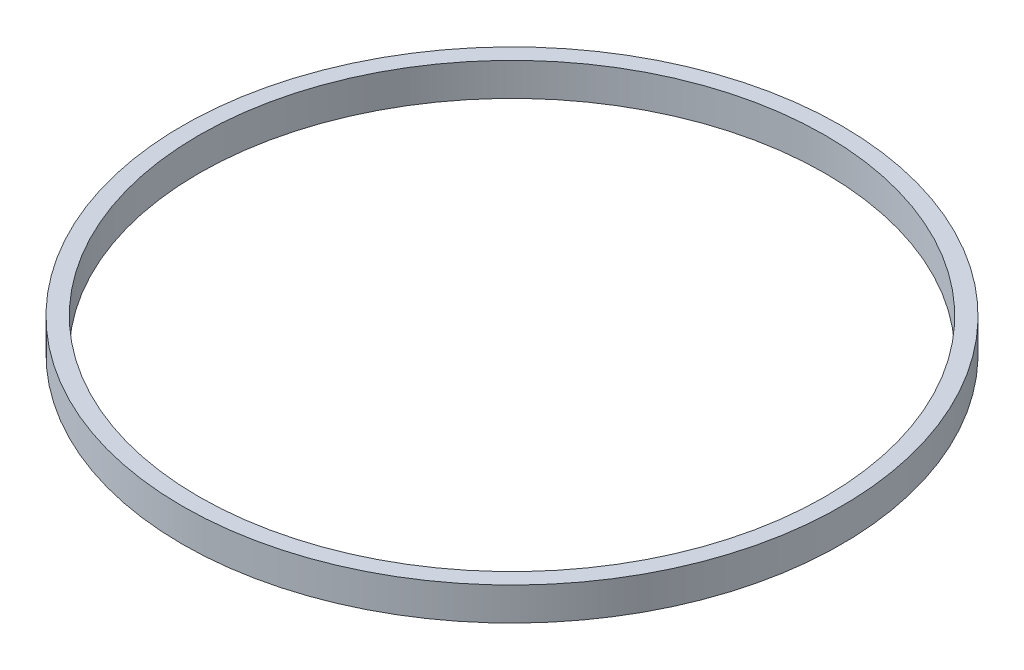
from build123d import *

# Parameters (mm, degrees)
SKETCH1_R           = 25.4
SKETCH1_R_2         = 24.13
BOSS_EXTRUDE1_DEPTH = 2.54


with BuildPart() as part:
    # Sketch1 → Boss-Extrude1 (new body)
    with BuildSketch(Plane(origin=(0, 0, 0), x_dir=(1, 0, 0), z_dir=(0, 1, 0))):
        with Locations(Location((0, 0, 0), (0, 0, 270))):
            Circle(SKETCH1_R)
        with Locations(Location((0, 0, 0), (0, 0, 270))):
            Circle(SKETCH1_R_2, mode=Mode.SUBTRACT)
    extrude(amount=BOSS_EXTRUDE1_DEPTH)


solid = part.part
